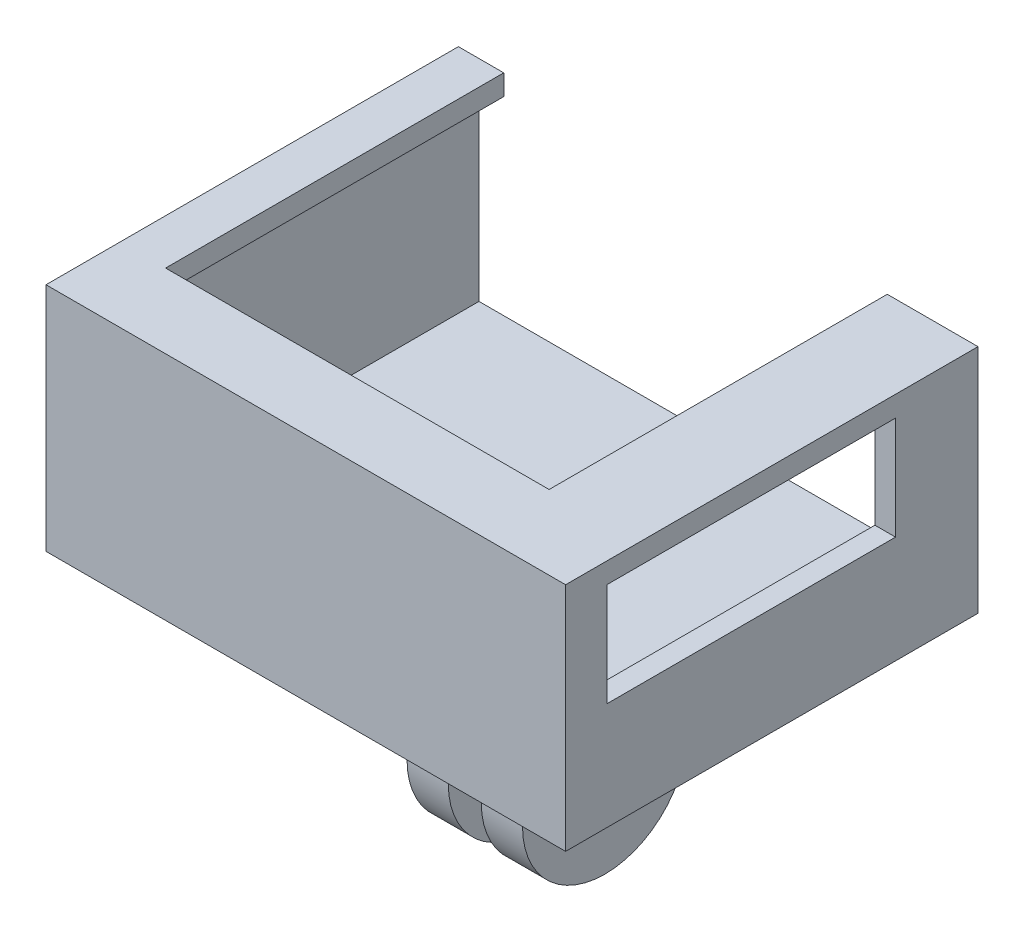
from build123d import *

# Parameters (mm, degrees)
SKETCH1_W            = 63
SKETCH1_H            = 50
BOSS_EXTRUDE1_DEPTH  = 28
CUT_EXTRUDE1_START   = -5
SKETCH2_W            = 60
SKETCH2_H            = 20
CUT_EXTRUDE1_DEPTH   = 62.748305375
CUT_EXTRUDE2_REACH   = 57.807
SKETCH3_W            = 40
SKETCH3_H            = 35
CUT_EXTRUDE3_REACH   = 57.807
SKETCH4_W            = 23
SKETCH4_H            = 25
SKETCH5_W            = 2.5
SKETCH5_H            = 25.5
BOSS_EXTRUDE2_DEPTH  = 35
SKETCH6_W            = 30
SKETCH6_H            = 15
CUT_EXTRUDE4_DEPTH   = 2.5
SKETCH7_W            = 2.5
SKETCH7_H            = 10.5
BOSS_EXTRUDE3_DEPTH  = 25
SKETCH8_W            = 5
SKETCH8_H            = 15
BOSS_EXTRUDE4_DEPTH  = 2.5
SKETCH9_W            = 10
SKETCH9_H            = 5.5
BOSS_EXTRUDE5_DEPTH  = 2.5
BOSS_EXTRUDE6_DEPTH  = 20
CUT_EXTRUDE6_START   = -5
CUT_EXTRUDE6_DEPTH   = 4
CUT_EXTRUDE8_START   = -5
CUT_EXTRUDE8_DEPTH   = 3
CUT_EXTRUDE9_DEPTH   = 64.548692085
SKETCH16_W           = 60.5
SKETCH16_H           = 5.5
CUT_EXTRUDE10_DEPTH  = 9
SKETCH17_W           = 10
SKETCH17_H           = 5.5
CUT_EXTRUDE11_DEPTH  = 18.5
SKETCH18_W           = 4.5
SKETCH18_H           = 5.5
BOSS_EXTRUDE7_DEPTH  = 34
SKETCH23_W           = 58
SKETCH23_H           = 45
CUT_EXTRUDE14_DEPTH  = 23
SKETCH24_W           = 2.5
SKETCH24_H           = 35
CUT_EXTRUDE15_DEPTH  = 3
BOSS_EXTRUDE9_START  = 56
SKETCH25_W           = 44
SKETCH25_H           = 2.5
BOSS_EXTRUDE9_DEPTH  = 3
SKETCH26_W           = 10
SKETCH26_H           = 20
BOSS_EXTRUDE10_DEPTH = 2.5
SKETCH27_W           = 44
SKETCH27_H           = 2.5
BOSS_EXTRUDE11_DEPTH = 6.5
SKETCH28_W           = 46.5
SKETCH28_H           = 2.5
BOSS_EXTRUDE12_DEPTH = 7
SKETCH29_W           = 46.5
SKETCH29_H           = 2.5
CUT_EXTRUDE16_DEPTH  = 4


with BuildPart() as part:
    # Sketch1 → Boss-Extrude1 (new body)
    with BuildSketch(Plane(origin=(0, 0, 0), x_dir=(1, 0, 0), z_dir=(0, 1, 0))):
        with Locations((2.724790291, -9.045064868)):
            Rectangle(SKETCH1_W, SKETCH1_H)
    extrude(amount=BOSS_EXTRUDE1_DEPTH)

    # Sketch2 → Cut-Extrude1 (cut, through all)
    with BuildSketch(Plane.XY.offset(34.045064868).offset(CUT_EXTRUDE1_START)):
        with Locations((1.724790291, 12.5)):
            Rectangle(SKETCH2_W, SKETCH2_H)
    extrude(amount=-CUT_EXTRUDE1_DEPTH, mode=Mode.SUBTRACT)

    # Cut-Extrude2: up to this face of the body (flat: up to its plane)
    cut_extrude2_end = Plane(part.part.faces().sort_by_distance((1.724790291, 2.5, 6.545064868))[0])
    # Sketch3 → Cut-Extrude2 (cut, up to the picked face)
    with BuildSketch(Plane(origin=(0, 28, 0), x_dir=(1, 0, 0), z_dir=(0, 1, 0)), mode=Mode.PRIVATE) as cut_extrude2_sk1:
        with Locations((-8.775209709, -1.545064868)):
            Rectangle(SKETCH3_W, SKETCH3_H)
    cut_extrude2_tool1 = split(extrude(cut_extrude2_sk1.sketch, amount=-CUT_EXTRUDE2_REACH, mode=Mode.PRIVATE), bisect_by=cut_extrude2_end, keep=Keep.BOTH, mode=Mode.PRIVATE)
    add(cut_extrude2_tool1.solids().sort_by(Axis((-8.77521, 28, 1.545065), (0, -1, 0)))[0], mode=Mode.SUBTRACT)

    # Cut-Extrude3: up to this face of the body (flat: up to its plane)
    cut_extrude3_end = Plane(part.part.faces().sort_by_distance((1.529988083, 2.5, 6.512866155))[0])
    # Sketch4 → Cut-Extrude3 (cut, up to the picked face)
    with BuildSketch(Plane(origin=(0, 28, 0), x_dir=(1, 0, 0), z_dir=(0, 1, 0)), mode=Mode.PRIVATE) as cut_extrude3_sk1:
        with Locations((22.724790291, -6.545064868)):
            Rectangle(SKETCH4_W, SKETCH4_H)
    cut_extrude3_tool1 = split(extrude(cut_extrude3_sk1.sketch, amount=-CUT_EXTRUDE3_REACH, mode=Mode.PRIVATE), bisect_by=cut_extrude3_end, keep=Keep.BOTH, mode=Mode.PRIVATE)
    add(cut_extrude3_tool1.solids().sort_by(Axis((22.72479, 28, 6.545065), (0, -1, 0)))[0], mode=Mode.SUBTRACT)

    # Sketch5 → Boss-Extrude2 (add)
    with BuildSketch(Plane(origin=(0, 0, 19.045064868), x_dir=(-1, 0, 0), z_dir=(0, 0, -1))):
        with Locations((27.525209709, 15.25)):
            Rectangle(SKETCH5_W, SKETCH5_H)
    extrude(amount=BOSS_EXTRUDE2_DEPTH)

    # Sketch6 → Cut-Extrude4 (cut)
    with BuildSketch(Plane(origin=(34.224790291, 0, 0), x_dir=(0, 0, -1), z_dir=(1, 0, 0))):
        with Locations((-19.045064868, 20.5)):
            Rectangle(SKETCH6_W, SKETCH6_H)
    extrude(amount=-CUT_EXTRUDE4_DEPTH, mode=Mode.SUBTRACT)

    # Sketch7 → Boss-Extrude3 (add)
    with BuildSketch(Plane(origin=(0, 0, 19.045064868), x_dir=(-1, 0, 0), z_dir=(0, 0, -1))):
        with Locations((-32.974790291, 7.75)):
            Rectangle(SKETCH7_W, SKETCH7_H)
    extrude(amount=BOSS_EXTRUDE3_DEPTH)

    # Sketch8 → Boss-Extrude4 (add)
    with BuildSketch(Plane(origin=(31.724790291, 0, 0), x_dir=(0, 0, -1), z_dir=(1, 0, 0))):
        with Locations((-31.545064868, 20.5)):
            Rectangle(SKETCH8_W, SKETCH8_H)
    extrude(amount=BOSS_EXTRUDE4_DEPTH)

    # Sketch9 → Boss-Extrude5 (add)
    with BuildSketch(Plane(origin=(31.724790291, 0, 0), x_dir=(0, 0, -1), z_dir=(1, 0, 0))):
        with Locations((-24.045064868, 25.25)):
            Rectangle(SKETCH9_W, SKETCH9_H)
    extrude(amount=BOSS_EXTRUDE5_DEPTH)

    # Sketch11 → Boss-Extrude6 (add)
    with BuildSketch(Plane(origin=(0, 0, 0), x_dir=(0, 0, -1), z_dir=(1, 0, 0))):
        with BuildLine():
            Line((0.954935132, 0), (-19.045064868, 0))
            Line((-19.045064868, 0), (-19.045064868, -15))
            ThreePointArc((-19.045064868, -15), (-9.045064868, -25), (0.954935132, -15))
            Line((0.954935132, -15), (0.954935132, 0))
        make_face()
    extrude(amount=BOSS_EXTRUDE6_DEPTH)

    # Sketch12 → Cut-Extrude6 (cut)
    with BuildSketch(Plane.ZY.offset(CUT_EXTRUDE6_START)):
        with BuildLine():
            Line((19.045064868, -15), (19.045064868, 0))
            Line((19.045064868, 0), (-0.954935132, 0))
            Line((-0.954935132, 0), (-0.954935132, -15))
            ThreePointArc((-0.954935132, -15), (9.045064868, -25), (19.045064868, -15))
        make_face()
    extrude(amount=-CUT_EXTRUDE6_DEPTH, mode=Mode.SUBTRACT)

    # Sketch14 → Cut-Extrude8 (cut)
    with BuildSketch(Plane.ZY.offset(-9).offset(CUT_EXTRUDE8_START)):
        with BuildLine():
            Line((19.045064868, -15), (19.045064868, 0))
            Line((19.045064868, 0), (-0.954935132, 0))
            Line((-0.954935132, 0), (-0.954935132, -15))
            ThreePointArc((-0.954935132, -15), (9.045064868, -25), (19.045064868, -15))
        make_face()
    extrude(amount=-CUT_EXTRUDE8_DEPTH, mode=Mode.SUBTRACT)

    # Sketch15 → Cut-Extrude9 (cut, through all)
    with BuildSketch(Plane.ZY.offset(-17)):
        with BuildLine():
            Line((19.045064868, -15), (19.045064868, 0))
            Line((19.045064868, 0), (-0.954935132, 0))
            Line((-0.954935132, 0), (-0.954935132, -15))
            ThreePointArc((-0.954935132, -15), (9.045064868, -25), (19.045064868, -15))
        make_face()
    extrude(amount=-CUT_EXTRUDE9_DEPTH, mode=Mode.SUBTRACT)

    # Sketch16 → Cut-Extrude10 (cut)
    with BuildSketch(Plane(origin=(0, 0, 19.045064868), x_dir=(-1, 0, 0), z_dir=(0, 0, -1))):
        with Locations((-3.974790291, 25.25)):
            Rectangle(SKETCH16_W, SKETCH16_H)
    extrude(amount=-CUT_EXTRUDE10_DEPTH, mode=Mode.SUBTRACT)

    # Sketch17 → Cut-Extrude11 (cut)
    with BuildSketch(Plane.ZY.offset(-11.224790291)):
        with Locations((-10.954935132, 25.25)):
            Rectangle(SKETCH17_W, SKETCH17_H)
    extrude(amount=-CUT_EXTRUDE11_DEPTH, mode=Mode.SUBTRACT)

    # Sketch18 → Boss-Extrude7 (add)
    with BuildSketch(Plane.XY.offset(-5.954935132)):
        with Locations((31.974790291, 25.25)):
            Rectangle(SKETCH18_W, SKETCH18_H)
    extrude(amount=BOSS_EXTRUDE7_DEPTH)

    # Sketch23 → Cut-Extrude14 (cut)
    with BuildSketch(Plane(origin=(0, 2.5, 0), x_dir=(1, 0, 0), z_dir=(0, 1, 0))):
        with Locations((2.724790291, -6.545064868)):
            Rectangle(SKETCH23_W, SKETCH23_H)
    extrude(amount=CUT_EXTRUDE14_DEPTH, mode=Mode.SUBTRACT)

    # Sketch24 → Cut-Extrude15 (cut)
    with BuildSketch(Plane.XZ.offset(-22.5)):
        with Locations((32.974790291, 11.545064868)):
            Rectangle(SKETCH24_W, SKETCH24_H)
    extrude(amount=-CUT_EXTRUDE15_DEPTH, mode=Mode.SUBTRACT)

    # Sketch25 → Boss-Extrude9 (add)
    with BuildSketch(Plane.ZY.offset(-29.724790291).offset(BOSS_EXTRUDE9_START)):
        with Locations((6.045064868, 26.75)):
            Rectangle(SKETCH25_W, SKETCH25_H)
    extrude(amount=-BOSS_EXTRUDE9_DEPTH)

    # Sketch26 → Boss-Extrude10 (add)
    with BuildSketch(Plane.ZY.offset(28.775209709)):
        with Locations((24.045064868, 12.5)):
            Rectangle(SKETCH26_W, SKETCH26_H)
    extrude(amount=-BOSS_EXTRUDE10_DEPTH)

    # Sketch27 → Boss-Extrude11 (add)
    with BuildSketch(Plane.ZY.offset(-29.724790291)):
        with Locations((6.045064868, 26.75)):
            Rectangle(SKETCH27_W, SKETCH27_H)
    extrude(amount=BOSS_EXTRUDE11_DEPTH)

    # Sketch28 → Boss-Extrude12 (add)
    with BuildSketch(Plane(origin=(0, 0, 28.045064868), x_dir=(-1, 0, 0), z_dir=(0, 0, -1))):
        with Locations((0.025209709, 26.75)):
            Rectangle(SKETCH28_W, SKETCH28_H)
    extrude(amount=BOSS_EXTRUDE12_DEPTH)

    # Sketch29 → Cut-Extrude16 (cut)
    with BuildSketch(Plane(origin=(0, 0, 21.045064868), x_dir=(-1, 0, 0), z_dir=(0, 0, -1))):
        with Locations((0.025209709, 26.75)):
            Rectangle(SKETCH29_W, SKETCH29_H)
    extrude(amount=-CUT_EXTRUDE16_DEPTH, mode=Mode.SUBTRACT)


solid = part.part
